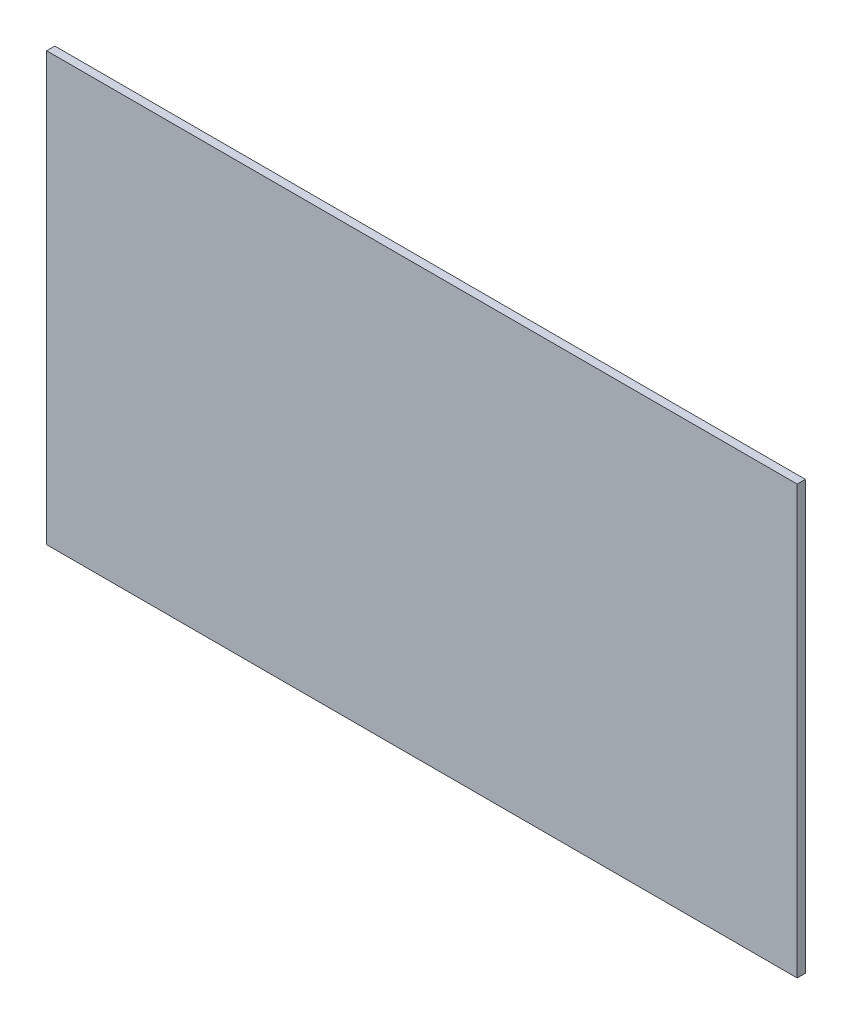
from build123d import *

# Parameters (mm, degrees)
SKETCH1_W           = 93
SKETCH1_H           = 53
BOSS_EXTRUDE1_DEPTH = 1.016


with BuildPart() as part:
    # Sketch1 → Boss-Extrude1 (new body)
    with BuildSketch(Plane.XY):
        with Locations((46.5, 26.5)):
            Rectangle(SKETCH1_W, SKETCH1_H)
    extrude(amount=BOSS_EXTRUDE1_DEPTH)


solid = part.part
